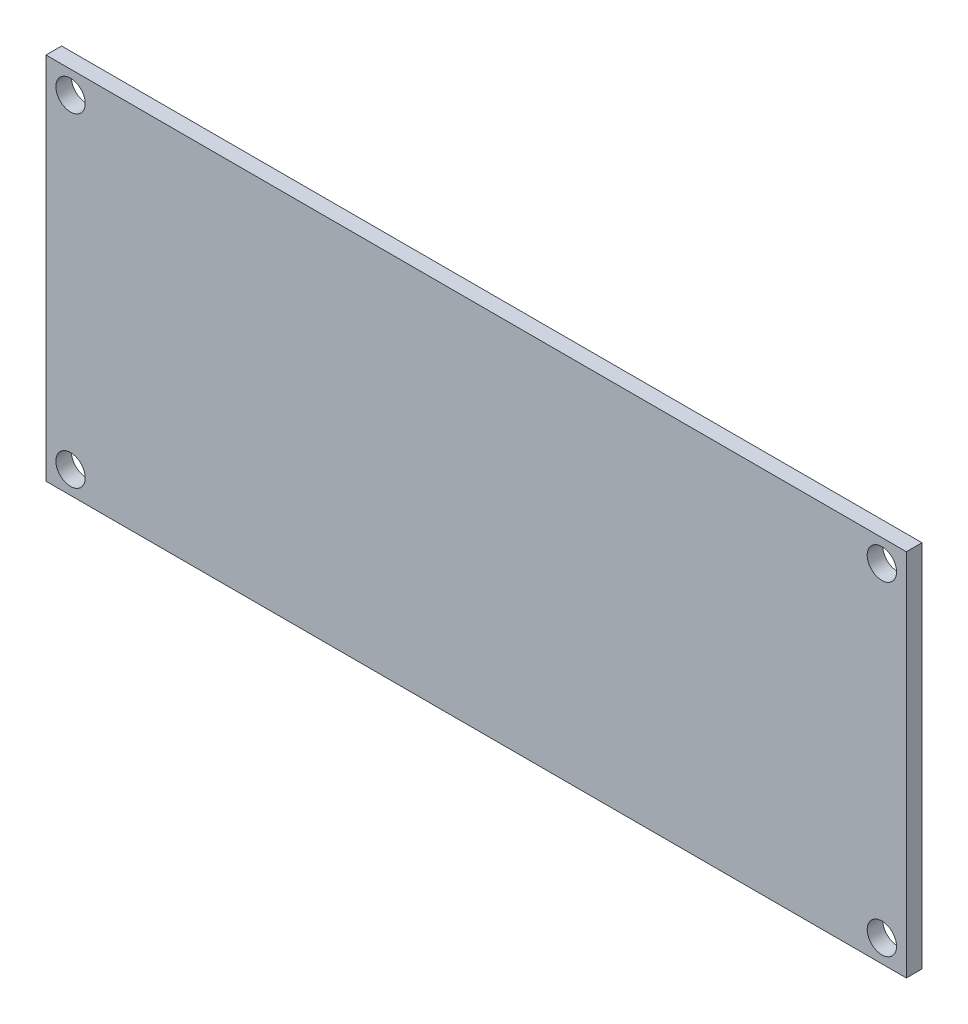
from build123d import *

# Parameters (mm, degrees)
SKETCH1_W           = 70.0278
SKETCH1_H           = 30.0482
SKETCH1_R           = 1.1938
BOSS_EXTRUDE1_DEPTH = 1.27


with BuildPart() as part:
    # Sketch1 → Boss-Extrude1 (new body)
    with BuildSketch(Plane.XY):
        with Locations((35.0139, 15.0241)):
            Rectangle(SKETCH1_W, SKETCH1_H)
        with Locations((1.9939, 28.2194)):
            Circle(SKETCH1_R, mode=Mode.SUBTRACT)
        with Locations((68.0339, 28.2194)):
            Circle(SKETCH1_R, mode=Mode.SUBTRACT)
        with Locations((1.9939, 1.8288)):
            Circle(SKETCH1_R, mode=Mode.SUBTRACT)
        with Locations((68.0339, 1.8288)):
            Circle(SKETCH1_R, mode=Mode.SUBTRACT)
    extrude(amount=BOSS_EXTRUDE1_DEPTH)


solid = part.part
